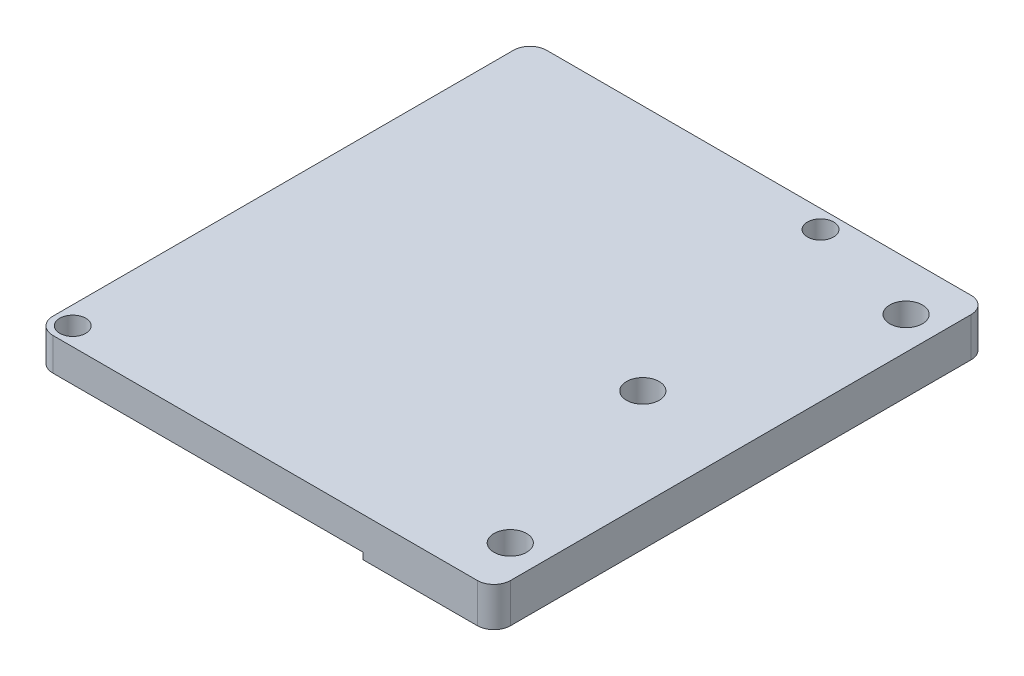
from build123d import *

# Parameters (mm, degrees)
SKETCH1_W           = 140.076
SKETCH1_H           = 151.13
BOSS_EXTRUDE1_DEPTH = 12
SKETCH2_W           = 100.076
SKETCH2_H           = 151.13
CUT_EXTRUDE1_DEPTH  = 2
SKETCH3_R           = 4
CUT_EXTRUDE2_DEPTH  = 8
CUT_EXTRUDE3_REACH  = 105.727
SKETCH4_R           = 2.75
FILLET1_R           = 5.08
SKETCH5_R           = 5
CUT_EXTRUDE4_DEPTH  = 9


with BuildPart() as part:
    # Sketch1 → Boss-Extrude1 (new body)
    with BuildSketch(Plane(origin=(0, 0, 0), x_dir=(1, 0, 0), z_dir=(0, 1, 0))):
        Rectangle(SKETCH1_W, SKETCH1_H)
    extrude(amount=BOSS_EXTRUDE1_DEPTH)

    # Sketch2 → Cut-Extrude1 (cut)
    with BuildSketch(Plane.XZ):
        with Locations((-20, 0)):
            Rectangle(SKETCH2_W, SKETCH2_H)
    extrude(amount=-CUT_EXTRUDE1_DEPTH, mode=Mode.SUBTRACT)

    # Sketch3 → Cut-Extrude2 (cut)
    with BuildSketch(Plane(origin=(0, 12, 0), x_dir=(1, 0, 0), z_dir=(0, 1, 0))):
        with Locations(Location((24.45, 69.977, 0), (0, 0, 270))):
            Circle(SKETCH3_R)
        with Locations(Location((-64.45, -69.977, 0), (0, 0, 270))):
            Circle(SKETCH3_R)
    extrude(amount=-CUT_EXTRUDE2_DEPTH, mode=Mode.SUBTRACT)

    # Sketch4 → Cut-Extrude3 (cut, up to next)
    with BuildSketch(Plane(origin=(0, 12, 0), x_dir=(1, 0, 0), z_dir=(0, 1, 0)), mode=Mode.PRIVATE) as cut_extrude3_sk1:
        with Locations(Location((40.038, 0, 0), (0, 0, 270))):
            Circle(SKETCH4_R)
    cut_extrude3_tool1 = extrude(cut_extrude3_sk1.sketch, amount=-CUT_EXTRUDE3_REACH, mode=Mode.PRIVATE) & part.part
    # Sketch4 → Cut-Extrude3 (cut, up to next)
    with BuildSketch(Plane(origin=(0, 12, 0), x_dir=(1, 0, 0), z_dir=(0, 1, 0)), mode=Mode.PRIVATE) as cut_extrude3_sk2:
        with Locations(Location((60.038, -60.565, 0), (0, 0, 270))):
            Circle(SKETCH4_R)
    cut_extrude3_tool2 = extrude(cut_extrude3_sk2.sketch, amount=-CUT_EXTRUDE3_REACH, mode=Mode.PRIVATE) & part.part
    # Sketch4 → Cut-Extrude3 (cut, up to next)
    with BuildSketch(Plane(origin=(0, 12, 0), x_dir=(1, 0, 0), z_dir=(0, 1, 0)), mode=Mode.PRIVATE) as cut_extrude3_sk3:
        with Locations(Location((60.038, 60.565, 0), (0, 0, 270))):
            Circle(SKETCH4_R)
    cut_extrude3_tool3 = extrude(cut_extrude3_sk3.sketch, amount=-CUT_EXTRUDE3_REACH, mode=Mode.PRIVATE) & part.part
    add(cut_extrude3_tool1.solids().sort_by_distance((40.038, 12, 0))[0], mode=Mode.SUBTRACT)
    add(cut_extrude3_tool2.solids().sort_by_distance((60.038, 12, 60.565))[0], mode=Mode.SUBTRACT)
    add(cut_extrude3_tool3.solids().sort_by_distance((60.038, 12, -60.565))[0], mode=Mode.SUBTRACT)

    # Fillet1
    fillet1_edges = [part.edges().sort_by_distance(p)[0] for p in [
        (70.038, 6, 75.565),
        (-70.038, 7, 75.565),
        (-70.038, 7, -75.565),
        (70.038, 6, -75.565),
    ]]
    fillet(fillet1_edges, radius=FILLET1_R)

    # Sketch5 → Cut-Extrude4 (cut)
    with BuildSketch(Plane(origin=(0, 12, 0), x_dir=(1, 0, 0), z_dir=(0, 1, 0))):
        with Locations(Location((60.038, 60.565, 0), (0, 0, 270))):
            Circle(SKETCH5_R)
        with Locations(Location((40.038, 0, 0), (0, 0, 270))):
            Circle(SKETCH5_R)
        with Locations(Location((60.038, -60.565, 0), (0, 0, 270))):
            Circle(SKETCH5_R)
    extrude(amount=-CUT_EXTRUDE4_DEPTH, mode=Mode.SUBTRACT)


solid = part.part
